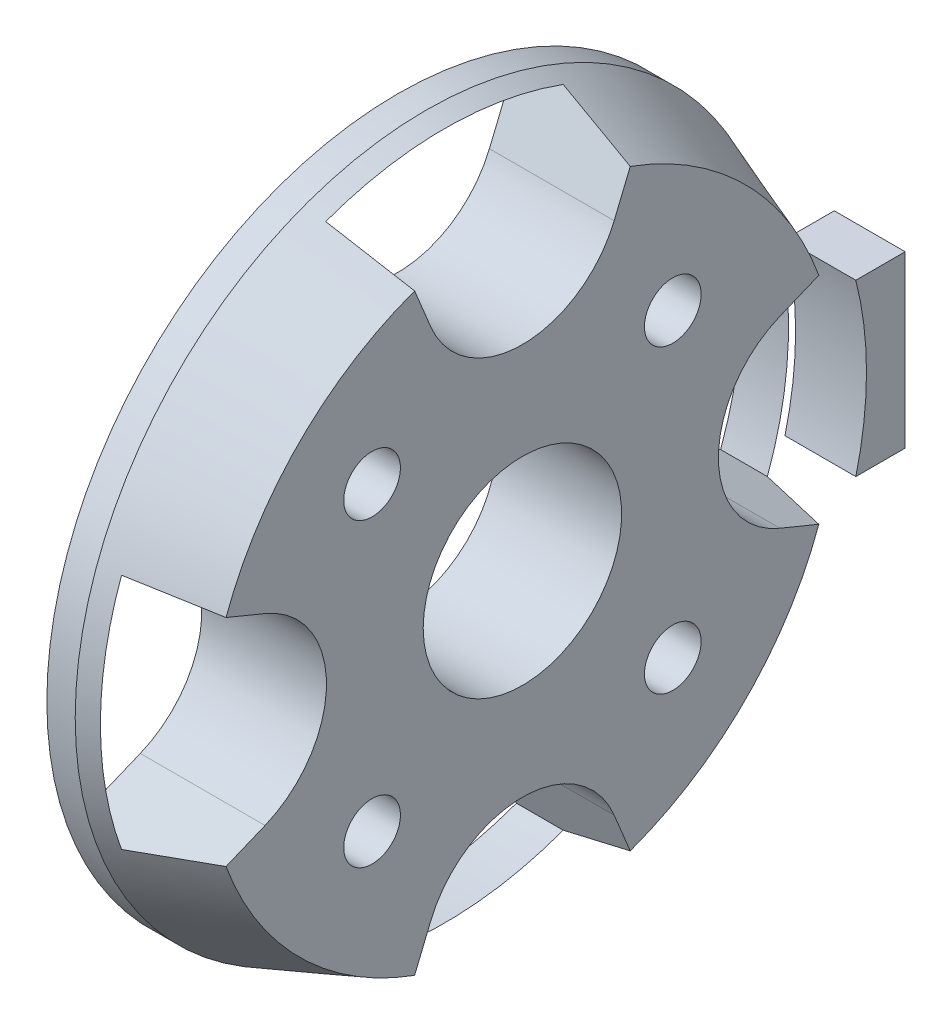
from build123d import *

# Parameters (mm, degrees)
SKETCH3_R           = 2
CUT_EXTRUDE1_DEPTH  = 5
SKETCH4_W           = 12
SKETCH4_H           = 12
BOSS_EXTRUDE1_DEPTH = 5
CUT_EXTRUDE2_DEPTH  = 38.669649587
CIRPATTERN1_COUNT   = 4


with BuildPart() as part:
    # Sketch2 → Revolve1 (revolve)
    with BuildSketch(Plane.XY, mode=Mode.PRIVATE) as revolve1_sk:
        Polygon((0, 24.75), (2, 24.75), (8.8, 22.25), (8.8, 7), (0, 7), align=None)
    revolve(revolve1_sk.sketch.rotate(Axis((0, 0, 0), (1, 0, 0)), 90), axis=Axis((0, 0, 0), (1, 0, 0)))

    # Sketch3 → Cut-Extrude1 (cut)
    with BuildSketch(Plane(origin=(8.8, 0, 0), x_dir=(0, 0, -1), z_dir=(1, 0, 0))):
        with Locations((10.606601718, 10.606601718)):
            Circle(SKETCH3_R)
        with Locations((10.606601718, -10.606601718)):
            Circle(SKETCH3_R)
        with Locations((-10.606601718, -10.606601718)):
            Circle(SKETCH3_R)
        with Locations((-10.606601718, 10.606601718)):
            Circle(SKETCH3_R)
    extrude(amount=-CUT_EXTRUDE1_DEPTH, mode=Mode.SUBTRACT)

    # Sketch4 → Boss-Extrude1 (add)
    with BuildSketch(Plane(origin=(8.8, 0, 0), x_dir=(0, 0, -1), z_dir=(1, 0, 0))):
        with Locations((21, 0)):
            Rectangle(SKETCH4_W, SKETCH4_H)
    extrude(amount=-BOSS_EXTRUDE1_DEPTH)

    # Sketch6 → Cut-Extrude2 (cut, through all)
    with BuildSketch(Plane(origin=(8.8, 0, 0), x_dir=(0, 0, -1), z_dir=(1, 0, 0))):
        with BuildLine():
            Line((-6.472300805, 18.157581623), (-7.606019278, 20.909590401))
            Line((-7.606019278, 20.909590401), (-8.376823121, 22.780653627))
            ThreePointArc((-8.376823121, 22.780653627), (0, 24.271986842), (8.376823121, 22.780653627))
            Line((8.376823121, 22.780653627), (7.606019278, 20.909590401))
            Line((7.606019278, 20.909590401), (6.472300805, 18.157581623))
            ThreePointArc((6.472300805, 18.157581623), (0, 13.823912866), (-6.472300805, 18.157581623))
        make_face()
    cut_extrude2 = extrude(amount=-CUT_EXTRUDE2_DEPTH, mode=Mode.SUBTRACT)

    # CirPattern1: Cut-Extrude2 ×4 about axis
    cirpattern1_axis = Axis((0, 0, 0), (1, 0, 0))
    for i in range(1, CIRPATTERN1_COUNT):
        add(cut_extrude2.rotate(cirpattern1_axis, i * 360 / CIRPATTERN1_COUNT), mode=Mode.SUBTRACT)


solid = part.part
